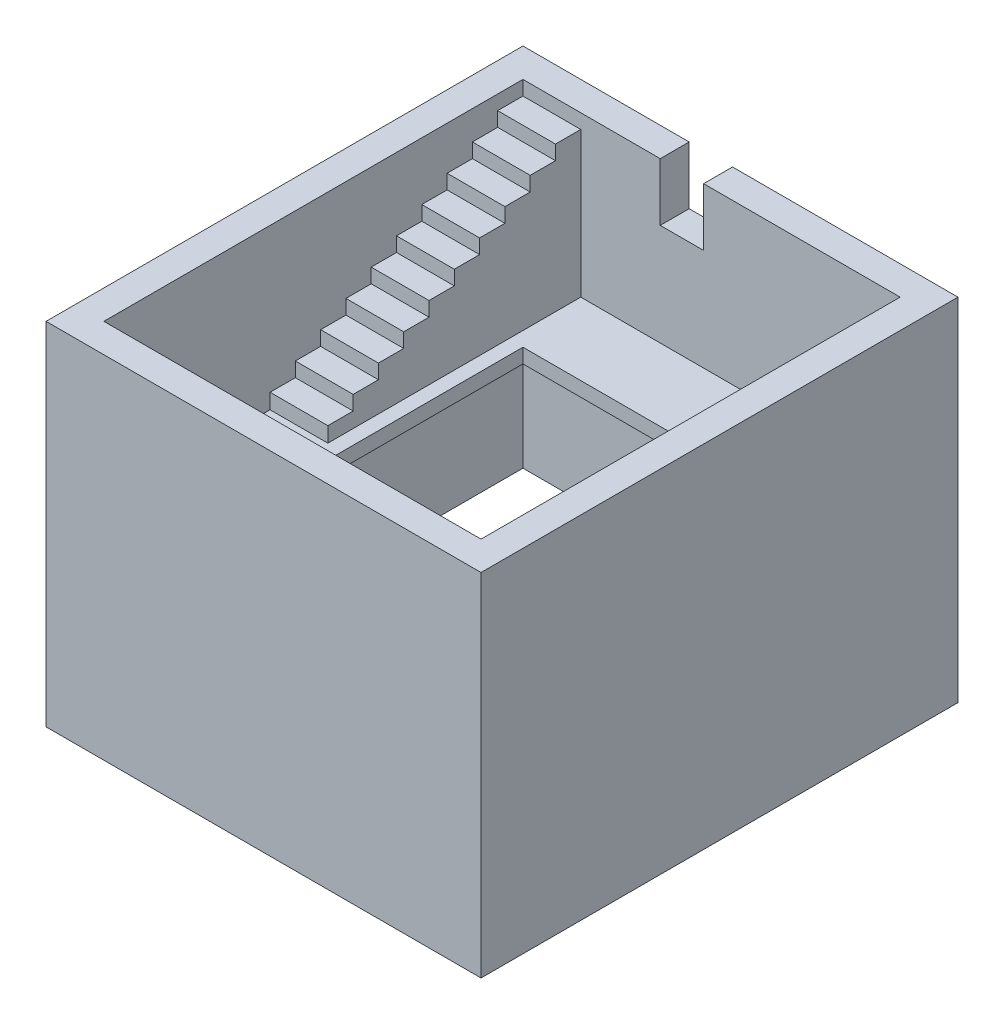
from build123d import *

# Parameters (mm, degrees)
CROQUIS1_W              = 6020
CROQUIS1_H              = 6600
CROQUIS1_W_2            = 5620
CROQUIS1_H_2            = 6200
SALIENTE_EXTRUIR1_DEPTH = 4860
CROQUIS2_W              = 6020
CROQUIS2_H              = 6600
SALIENTE_EXTRUIR2_DEPTH = 300
CROQUIS4_W              = 5620
CROQUIS4_H              = 6200
CROQUIS4_W_2            = 5220
CROQUIS4_H_2            = 5800
SALIENTE_EXTRUIR3_DEPTH = 2210
CROQUIS5_W              = 5620
CROQUIS5_H              = 6200
CORTAR_EXTRUIR1_DEPTH   = 300
CROQUIS7_W              = 5620
CROQUIS7_H              = 6200
CROQUIS7_W_2            = 3220
CROQUIS7_H_2            = 3800
SALIENTE_EXTRUIR5_DEPTH = 200
SALIENTE_EXTRUIR6_DEPTH = 800
CROQUIS9_W              = 600
CROQUIS9_H              = 800
CORTAR_EXTRUIR2_DEPTH   = 400


with BuildPart() as part:
    # Croquis1 → Saliente-Extruir1 (new body)
    with BuildSketch(Plane(origin=(0, 0, 0), x_dir=(1, 0, 0), z_dir=(0, 1, 0))):
        Rectangle(CROQUIS1_W, CROQUIS1_H)
        Rectangle(CROQUIS1_W_2, CROQUIS1_H_2, mode=Mode.SUBTRACT)
    extrude(amount=SALIENTE_EXTRUIR1_DEPTH)

    # Croquis2 → Saliente-Extruir2 (add)
    with BuildSketch(Plane.XZ):
        Rectangle(CROQUIS2_W, CROQUIS2_H)
    extrude(amount=-SALIENTE_EXTRUIR2_DEPTH)

    # Croquis4 → Saliente-Extruir3 (add)
    with BuildSketch(Plane(origin=(0, 4860, 0), x_dir=(1, 0, 0), z_dir=(0, 1, 0))):
        Rectangle(CROQUIS4_W, CROQUIS4_H)
        Rectangle(CROQUIS4_W_2, CROQUIS4_H_2, mode=Mode.SUBTRACT)
    extrude(amount=-SALIENTE_EXTRUIR3_DEPTH)

    # Croquis5 → Cortar-Extruir1 (cut)
    with BuildSketch(Plane.XZ):
        Rectangle(CROQUIS5_W, CROQUIS5_H)
    extrude(amount=-CORTAR_EXTRUIR1_DEPTH, mode=Mode.SUBTRACT)

    # Croquis7 → Saliente-Extruir5 (add)
    with BuildSketch(Plane.XZ.offset(-2650)):
        Rectangle(CROQUIS7_W, CROQUIS7_H)
        Rectangle(CROQUIS7_W_2, CROQUIS7_H_2, mode=Mode.SUBTRACT)
    extrude(amount=SALIENTE_EXTRUIR5_DEPTH)

    # Croquis8 → Saliente-Extruir6 (add)
    with BuildSketch(Plane(origin=(-2610, 0, 0), x_dir=(0, 0, -1), z_dir=(1, 0, 0))):
        Polygon((2900, 4660), (2550, 4660), (2550, 4460), (2200, 4460), (2200, 4260), (1850, 4260), (1850, 4060), (1500, 4060), (1500, 3860), (1150, 3860), (1150, 3660), (800, 3660), (800, 3460), (450, 3460), (450, 3260), (100, 3260), (100, 3060), (-250, 3060), (-250, 2860), (-600, 2860), (-600, 2649.927866399), (2900, 2650), align=None)
    extrude(amount=SALIENTE_EXTRUIR6_DEPTH)

    # Croquis9 → Cortar-Extruir2 (cut)
    with BuildSketch(Plane(origin=(0, 0, -3300), x_dir=(-1, 0, 0), z_dir=(0, 0, -1))):
        with Locations((410, 4460)):
            Rectangle(CROQUIS9_W, CROQUIS9_H)
    extrude(amount=-CORTAR_EXTRUIR2_DEPTH, mode=Mode.SUBTRACT)


solid = part.part
